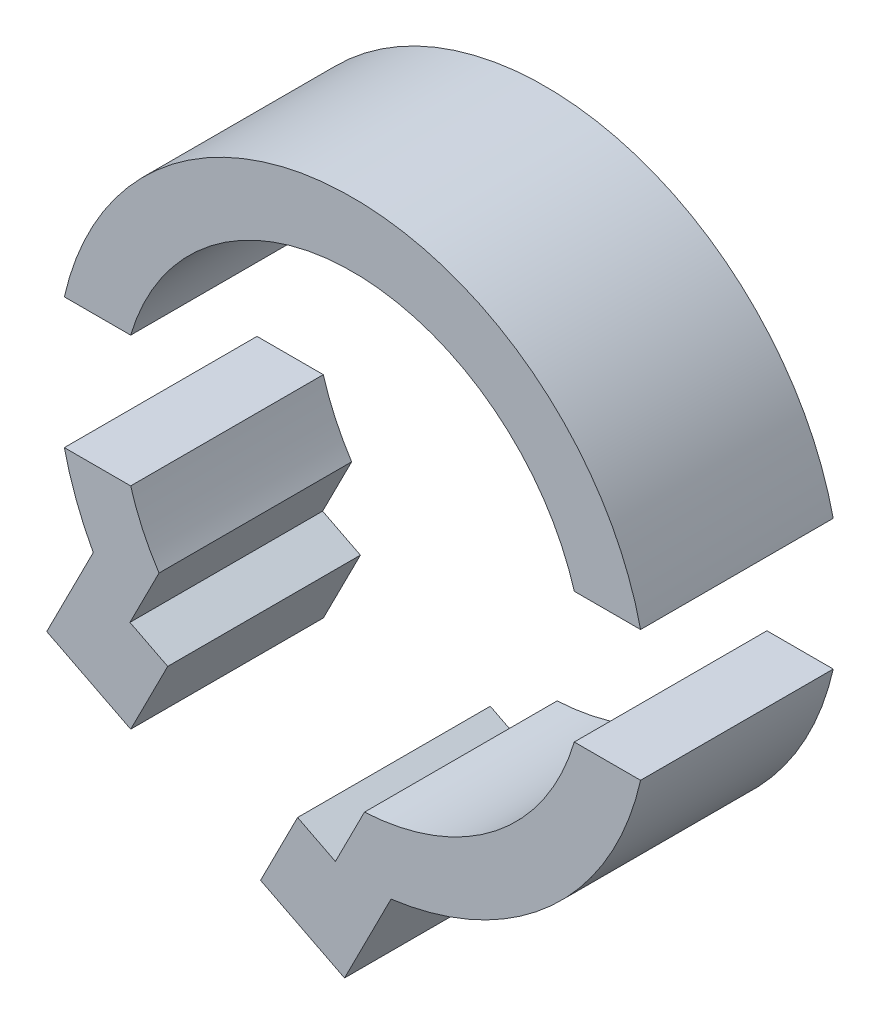
from build123d import *

# Parameters (mm, degrees)
SKETCH1_R           = 23
SKETCH1_R_2         = 18
BOSS_EXTRUDE1_DEPTH = 15
BOSS_EXTRUDE2_DEPTH = 15
CUT_EXTRUDE1_DEPTH  = 21
BOSS_EXTRUDE3_DEPTH = 21
SKETCH7_R           = 2.2
CUT_EXTRUDE2_DEPTH  = 21
CUT_EXTRUDE3_DEPTH  = 21
SKETCH9_W           = 54.729163564
SKETCH9_H           = 10.162331038
CUT_EXTRUDE4_DEPTH  = 21
CUT_EXTRUDE5_DEPTH  = 21


with BuildPart() as part:
    # Sketch1 → Boss-Extrude1 (new body)
    with BuildSketch(Plane.XY):
        Circle(SKETCH1_R)
        Circle(SKETCH1_R_2, mode=Mode.SUBTRACT)
    extrude(amount=BOSS_EXTRUDE1_DEPTH)

    # Sketch3 → Boss-Extrude2 (add)
    with BuildSketch(Plane.XY):
        with BuildLine():
            Line((-23.80139919, -18.167885182), (-0.617388595, -29.936557696))
            Line((-0.617388595, -29.936557696), (3.003741409, -22.803015975))
            ThreePointArc((3.003741409, -22.803015975), (-10.410748762, -20.508932449), (-20.180269185, -11.034343461))
            Line((-20.180269185, -11.034343461), (-23.80139919, -18.167885182))
        make_face()
    extrude(amount=BOSS_EXTRUDE2_DEPTH)

    # Sketch5 → Cut-Extrude1 (cut)
    with BuildSketch(Plane.XY):
        with BuildLine():
            Line((-15.062285021, -9.855332057), (-17.325491273, -14.313795633))
            Line((-17.325491273, -14.313795633), (-1.328523963, -22.434179668))
            Line((-1.328523963, -22.434179668), (0.93468229, -17.975716092))
            ThreePointArc((0.93468229, -17.975716092), (-8.14754251, -16.050468873), (-15.062285021, -9.855332057))
        make_face()
    extrude(amount=CUT_EXTRUDE1_DEPTH, mode=Mode.SUBTRACT)

    # Sketch6 → Boss-Extrude3 (add)
    with BuildSketch(Plane.XY):
        with BuildLine():
            ThreePointArc((-22.555487137, -4.5), (-26.136916399, 0), (-22.555487137, 4.5))
            ThreePointArc((-22.555487137, 4.5), (-23, 0), (-22.555487137, -4.5))
        make_face()
        with BuildLine():
            ThreePointArc((22.555487137, -4.5), (25.860234666, 0), (22.555487137, 4.5))
            ThreePointArc((22.555487137, 4.5), (23, 0), (22.555487137, -4.5))
        make_face()
    extrude(amount=BOSS_EXTRUDE3_DEPTH)

    # Sketch7 → Cut-Extrude2 (cut)
    with BuildSketch(Plane.XY):
        with Locations(Location((-21.5, 0, 0), (0, 0, 130.877182194))):
            Circle(SKETCH7_R)
        with Locations(Location((21.5, 0, 0), (0, 0, 49.122817806))):
            Circle(SKETCH7_R)
    extrude(amount=CUT_EXTRUDE2_DEPTH, mode=Mode.SUBTRACT)

    # Sketch8 → Cut-Extrude3 (cut)
    with BuildSketch(Plane.XY):
        Polygon((-14.382905313, -15.80751176), (-4.271109923, -20.940463541), (-5.629033675, -23.615541687), (-15.740829065, -18.482589905), align=None)
    extrude(amount=CUT_EXTRUDE3_DEPTH, mode=Mode.SUBTRACT)

    # Sketch9 → Cut-Extrude4 (cut)
    with BuildSketch(Plane.XY):
        Rectangle(SKETCH9_W, SKETCH9_H)
    extrude(amount=CUT_EXTRUDE4_DEPTH, mode=Mode.SUBTRACT)


with BuildPart() as cut_extrude4_piece_1:
    # of the separate pieces the step leaves, piece 1, a body of its own (cut_extrude4_pieces)
    add(part.part.solids().sort_by_distance((3.003741409, -22.803015975, 0))[0])

    # Sketch10 → Cut-Extrude5 (cut)
    with BuildSketch(Plane.XY):
        Polygon((-15.740829065, -18.482589905), (-5.629033675, -23.615541687), (-7.153496197, -26.61869733), (-17.265291587, -21.485745549), align=None)
    extrude(amount=CUT_EXTRUDE5_DEPTH, mode=Mode.SUBTRACT)


with BuildPart() as cut_extrude4_piece_2:
    # of the separate pieces the step leaves, piece 2, a body of its own (cut_extrude4_pieces)
    add(part.part.solids().sort_by_distance((-17.267940148, 5.081165519, 0))[0])


with BuildPart() as cut_extrude5_piece_1:
    # of the separate pieces the step leaves, piece 1, a body of its own (cut_extrude5_pieces)
    add(cut_extrude4_piece_1.part.solids().sort_by_distance((3.003741409, -22.803015975, 0))[0])


with BuildPart() as cut_extrude5_piece_2:
    # of the separate pieces the step leaves, piece 2, a body of its own (cut_extrude5_pieces)
    add(cut_extrude4_piece_1.part.solids().sort_by_distance((-22.431713197, -5.081165519, 0))[0])


solid = Compound([cut_extrude4_piece_2.part, cut_extrude5_piece_1.part, cut_extrude5_piece_2.part])
